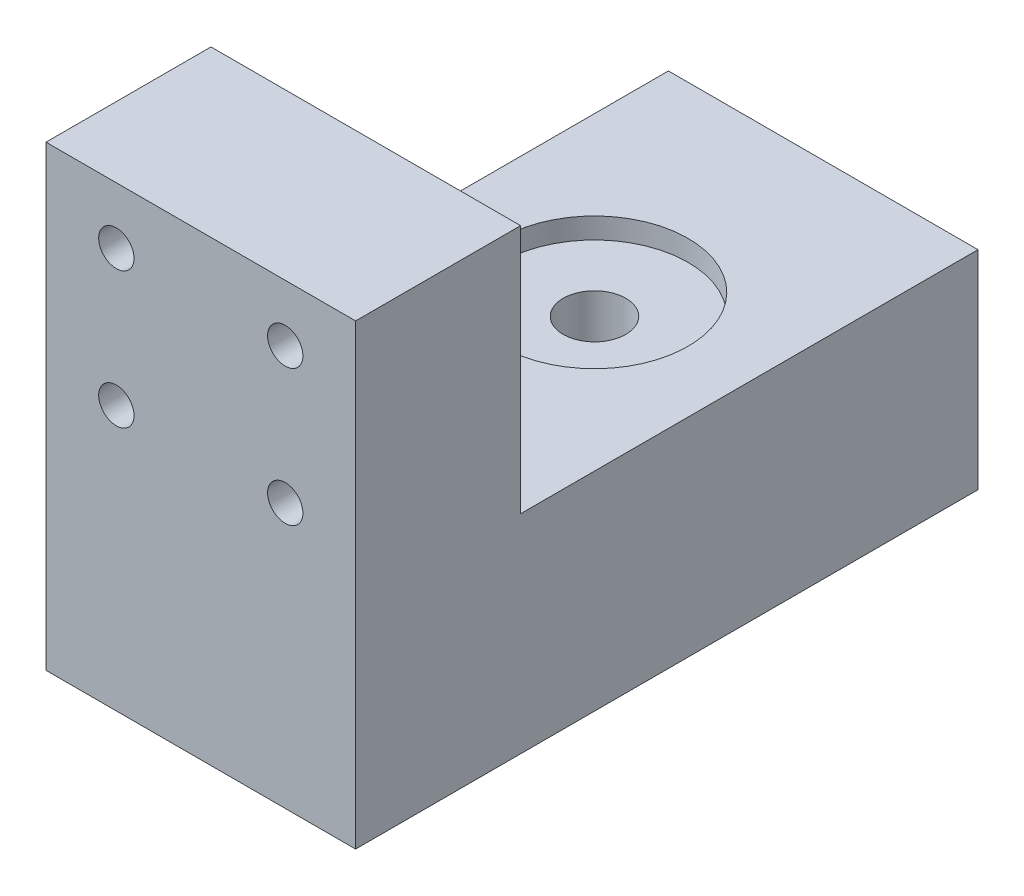
from build123d import *

# Parameters (mm, degrees)
SKETCH1_W           = 29.78
SKETCH1_H           = 20
BOSS_EXTRUDE2_DEPTH = 44
SKETCH4_W           = 29.78
SKETCH4_H           = 44
BOSS_EXTRUDE3_DEPTH = 15.87
SKETCH5_R           = 9
CUT_EXTRUDE1_DEPTH  = 2
SKETCH7_R           = 3.0125
CUT_EXTRUDE2_DEPTH  = 67.948704244
SKETCH8_R           = 1.7
CUT_EXTRUDE3_DEPTH  = 58.564851255


with BuildPart() as part:
    # Sketch1 → Boss-Extrude2 (new body)
    with BuildSketch(Plane.XY):
        Rectangle(SKETCH1_W, SKETCH1_H)
    extrude(amount=BOSS_EXTRUDE2_DEPTH)

    # Sketch4 → Boss-Extrude3 (add)
    with BuildSketch(Plane.XY.offset(44)):
        with Locations((0, 12)):
            Rectangle(SKETCH4_W, SKETCH4_H)
    extrude(amount=BOSS_EXTRUDE3_DEPTH)

    # Sketch5 → Cut-Extrude1 (cut)
    with BuildSketch(Plane(origin=(0, 10, 0), x_dir=(1, 0, 0), z_dir=(0, 1, 0))):
        with Locations(Location((0, -22, 0), (0, 0, 180))):
            Circle(SKETCH5_R)
    extrude(amount=-CUT_EXTRUDE1_DEPTH, mode=Mode.SUBTRACT)

    # Sketch7 → Cut-Extrude2 (cut, through all)
    with BuildSketch(Plane(origin=(0, 8, 0), x_dir=(1, 0, 0), z_dir=(0, 1, 0))):
        with Locations(Location((0, -22, 0), (0, 0, 180))):
            Circle(SKETCH7_R)
    extrude(amount=-CUT_EXTRUDE2_DEPTH, mode=Mode.SUBTRACT)

    # Sketch8 → Cut-Extrude3 (cut, through all)
    with BuildSketch(Plane(origin=(0, 0, 44), x_dir=(-1, 0, 0), z_dir=(0, 0, -1))):
        with Locations((-8.123713821, 28.54698226)):
            Circle(SKETCH8_R)
        with Locations((8.123713821, 28.54698226)):
            Circle(SKETCH8_R)
        with Locations((-8.123713821, 15.45301774)):
            Circle(SKETCH8_R)
        with Locations((8.123713821, 15.45301774)):
            Circle(SKETCH8_R)
    extrude(amount=-CUT_EXTRUDE3_DEPTH, mode=Mode.SUBTRACT)


solid = part.part
